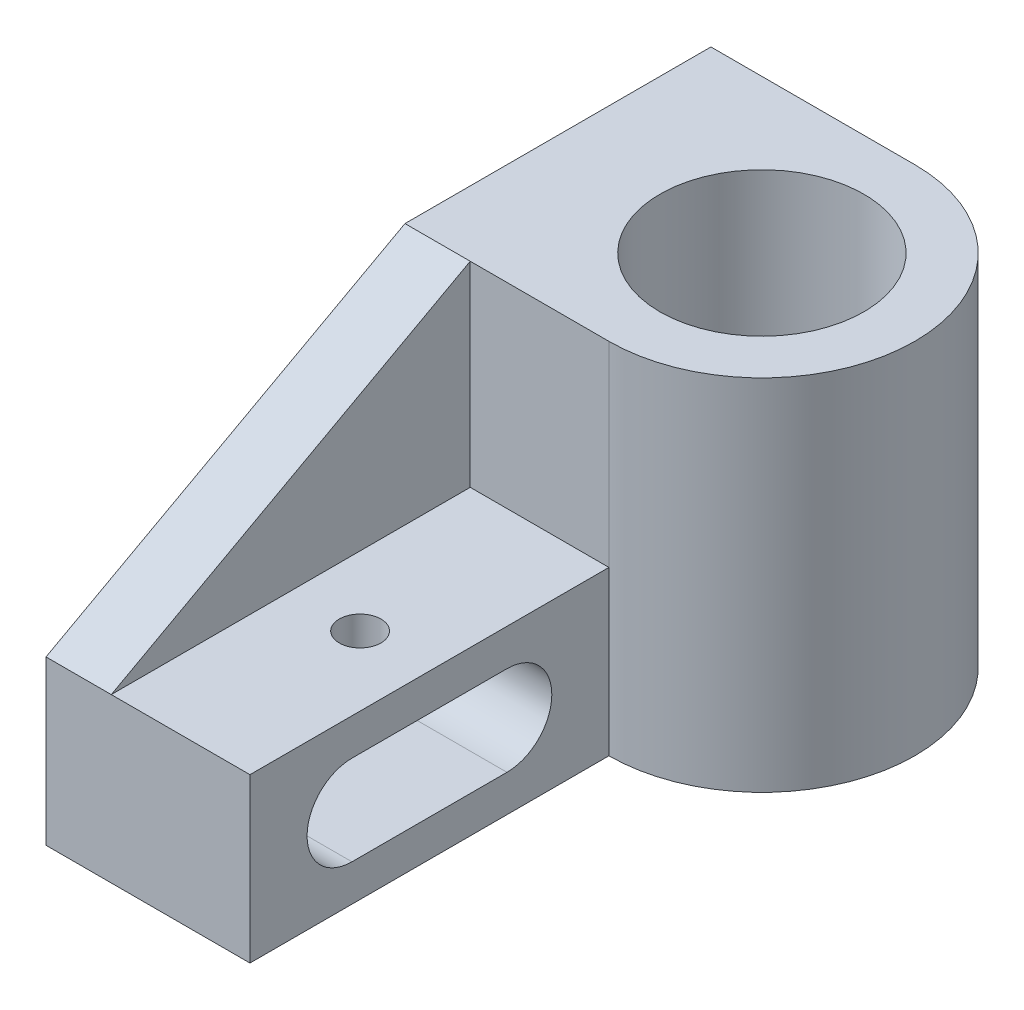
from build123d import *

# Parameters (mm, degrees)
BOSS_EXTRUDE1_DEPTH = 87.5
SKETCH1_3_W         = 88
SKETCH1_3_H         = 40
BOSS_EXTRUDE2_DEPTH = 50
BOSS_EXTRUDE3_DEPTH = 16
FILLET1_RADIUS      = 37.5
FILLET1_LENGTH      = 88
CUT_EXTRUDE1_REACH  = 206.864
SKETCH4_R           = 25
SKETCH4_R_2         = 5.1


with BuildPart() as part:
    # Sketch1 → Boss-Extrude1 (new body)
    with BuildSketch(Plane(origin=(0, 0, 0), x_dir=(0, 0, -1), z_dir=(1, 0, 0))):
        Polygon((88, 40), (88, 0), (163, 0), (163, 88), (88, 88), align=None)
    extrude(amount=BOSS_EXTRUDE1_DEPTH)

    # Sketch1<3> → Boss-Extrude2 (add)
    with BuildSketch(Plane(origin=(0, 0, 0), x_dir=(0, 0, -1), z_dir=(1, 0, 0))):
        with Locations((44, 20)):
            Rectangle(SKETCH1_3_W, SKETCH1_3_H)
        with BuildLine():
            ThreePointArc((25, 9), (14, 20), (25, 31))
            Line((25, 31), (63, 31))
            ThreePointArc((63, 31), (74, 20), (63, 9))
            Line((63, 9), (25, 9))
        make_face(mode=Mode.SUBTRACT)
    extrude(amount=BOSS_EXTRUDE2_DEPTH)

    # Sketch1<4> → Boss-Extrude3 (add)
    with BuildSketch(Plane(origin=(0, 0, 0), x_dir=(0, 0, -1), z_dir=(1, 0, 0))):
        Polygon((88, 88), (0, 40), (88, 40), align=None)
    extrude(amount=BOSS_EXTRUDE3_DEPTH)

    # Fillet1: full round fillet: the end face becomes a half cylinder, R = half its width
    fillet1_face = Plane((87.5, 44, -125.5), x_dir=(0, 1, 0), z_dir=(1, 0, 0))  # on the end face: x along it, z out of the body
    fillet1_slab = fillet1_face.offset(-FILLET1_RADIUS / 2) * Box(FILLET1_LENGTH, 2 * FILLET1_RADIUS, FILLET1_RADIUS, mode=Mode.PRIVATE)  # the body's end, R deep
    fillet1_round = Plane((50, 44, -125.5), x_dir=(1, 0, 0), z_dir=(0, 1, 0)) * Cylinder(FILLET1_RADIUS, FILLET1_LENGTH, mode=Mode.PRIVATE)  # its axis R under the face
    add(fillet1_slab - fillet1_round, mode=Mode.SUBTRACT)

    # Sketch4 → Cut-Extrude1 (cut, up to next)
    with BuildSketch(Plane(origin=(0, 88, 0), x_dir=(1, 0, 0), z_dir=(0, 1, 0)), mode=Mode.PRIVATE) as cut_extrude1_sk1:
        with Locations(Location((50, 125.5, 0), (0, 0, 270))):
            Circle(SKETCH4_R)
    cut_extrude1_tool1 = extrude(cut_extrude1_sk1.sketch, amount=-CUT_EXTRUDE1_REACH, mode=Mode.PRIVATE) & part.part
    # Sketch4 → Cut-Extrude1 (cut, up to next)
    with BuildSketch(Plane(origin=(0, 88, 0), x_dir=(1, 0, 0), z_dir=(0, 1, 0)), mode=Mode.PRIVATE) as cut_extrude1_sk2:
        with Locations(Location((33, 44, 0), (0, 0, 270))):
            Circle(SKETCH4_R_2)
    cut_extrude1_tool2 = extrude(cut_extrude1_sk2.sketch, amount=-CUT_EXTRUDE1_REACH, mode=Mode.PRIVATE) & part.part
    add(cut_extrude1_tool1.solids().sort_by_distance((50, 88, -125.5))[0], mode=Mode.SUBTRACT)
    add(cut_extrude1_tool2.solids().sort_by_distance((33, 88, -44))[0], mode=Mode.SUBTRACT)


solid = part.part
